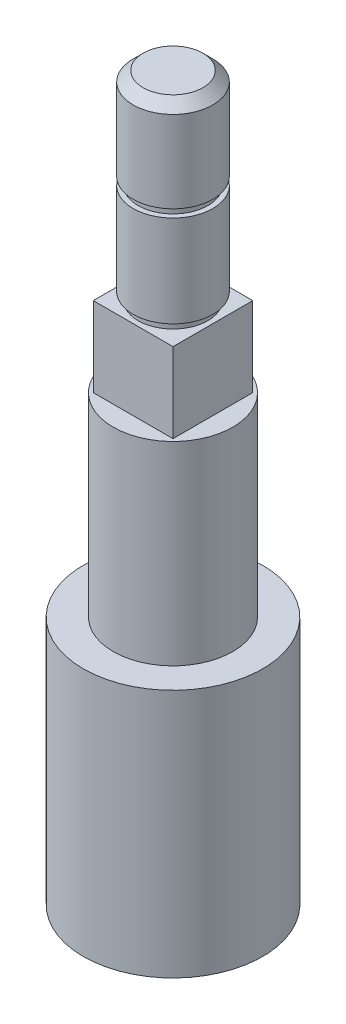
from build123d import *

# Parameters (mm, degrees)
SKETCH_1_R          = 9
EXTRUDE_1_DEPTH     = 25
SKETCH_2_R          = 4
CUT_EXTRUDE_1_DEPTH = 20
SKETCH_6_R          = 6
EXTRUDE_4_DEPTH     = 19.5
SKETCH_3_W          = 8
SKETCH_3_H          = 8
EXTRUDE_2_DEPTH     = 8
SKETCH_4_R          = 4
EXTRUDE_3_DEPTH     = 20
SKETCH_5_R          = 1.5
CUT_EXTRUDE_2_DEPTH = 74.608763065
CHAMFER_1_SIZE      = 1
SKETCH_7_W          = 0.5
SKETCH_7_H          = 0.8


with BuildPart() as part:
    # 草图1 → 凸台-拉伸1 (new body)
    with BuildSketch(Plane(origin=(0, 0, 0), x_dir=(1, 0, 0), z_dir=(0, 1, 0))):
        with Locations(Location((0, 0, 0), (0, 0, 270))):
            Circle(SKETCH_1_R)
    extrude(amount=EXTRUDE_1_DEPTH)

    # 草图2 → 切除-拉伸1 (cut)
    with BuildSketch(Plane.XZ):
        with Locations(Location((0, 0, 0), (0, 0, 270))):
            Circle(SKETCH_2_R)
    extrude(amount=-CUT_EXTRUDE_1_DEPTH, mode=Mode.SUBTRACT)

    # 草图6 → 凸台-拉伸4 (add)
    with BuildSketch(Plane(origin=(0, 25, 0), x_dir=(1, 0, 0), z_dir=(0, 1, 0))):
        with Locations(Location((0, 0, 0), (0, 0, 270))):
            Circle(SKETCH_6_R)
    extrude(amount=EXTRUDE_4_DEPTH)

    # 草图3 → 凸台-拉伸2 (add)
    with BuildSketch(Plane(origin=(0, 44.5, 0), x_dir=(1, 0, 0), z_dir=(0, 1, 0))):
        Rectangle(SKETCH_3_W, SKETCH_3_H)
    extrude(amount=EXTRUDE_2_DEPTH)

    # 草图4 → 凸台-拉伸3 (add)
    with BuildSketch(Plane(origin=(0, 52.5, 0), x_dir=(1, 0, 0), z_dir=(0, 1, 0))):
        with Locations(Location((0, 0, 0), (0, 0, 90))):
            Circle(SKETCH_4_R)
    extrude(amount=EXTRUDE_3_DEPTH)

    # 草图5 → 切除-拉伸2 (cut, through all)
    with BuildSketch(Plane(origin=(0, 0, 0), x_dir=(0, 0, -1), z_dir=(1, 0, 0))):
        with Locations((0, 10)):
            Circle(SKETCH_5_R)
    extrude(amount=-CUT_EXTRUDE_2_DEPTH, mode=Mode.SUBTRACT)

    # 倒角1
    chamfer_1_edges = [part.edges().sort_by_distance(p)[0] for p in [
        (0, 72.5, 4),
    ]]
    chamfer(chamfer_1_edges, length=CHAMFER_1_SIZE)

    # 草图7 → 切除-旋转1 (revolve, cut)
    with BuildSketch(Plane(origin=(0, 0, 0), x_dir=(0, 0, -1), z_dir=(1, 0, 0)), mode=Mode.PRIVATE) as cut_revolve_1_sk:
        with Locations((3.75, 62.9)):
            Rectangle(SKETCH_7_W, SKETCH_7_H)
        with Locations((3.75, 52.9)):
            Rectangle(SKETCH_7_W, SKETCH_7_H)
    revolve(cut_revolve_1_sk.sketch.rotate(Axis((0, 72.5, 0), (0, -1, 0)), 180), axis=Axis((0, 72.5, 0), (0, -1, 0)), mode=Mode.SUBTRACT)


solid = part.part
